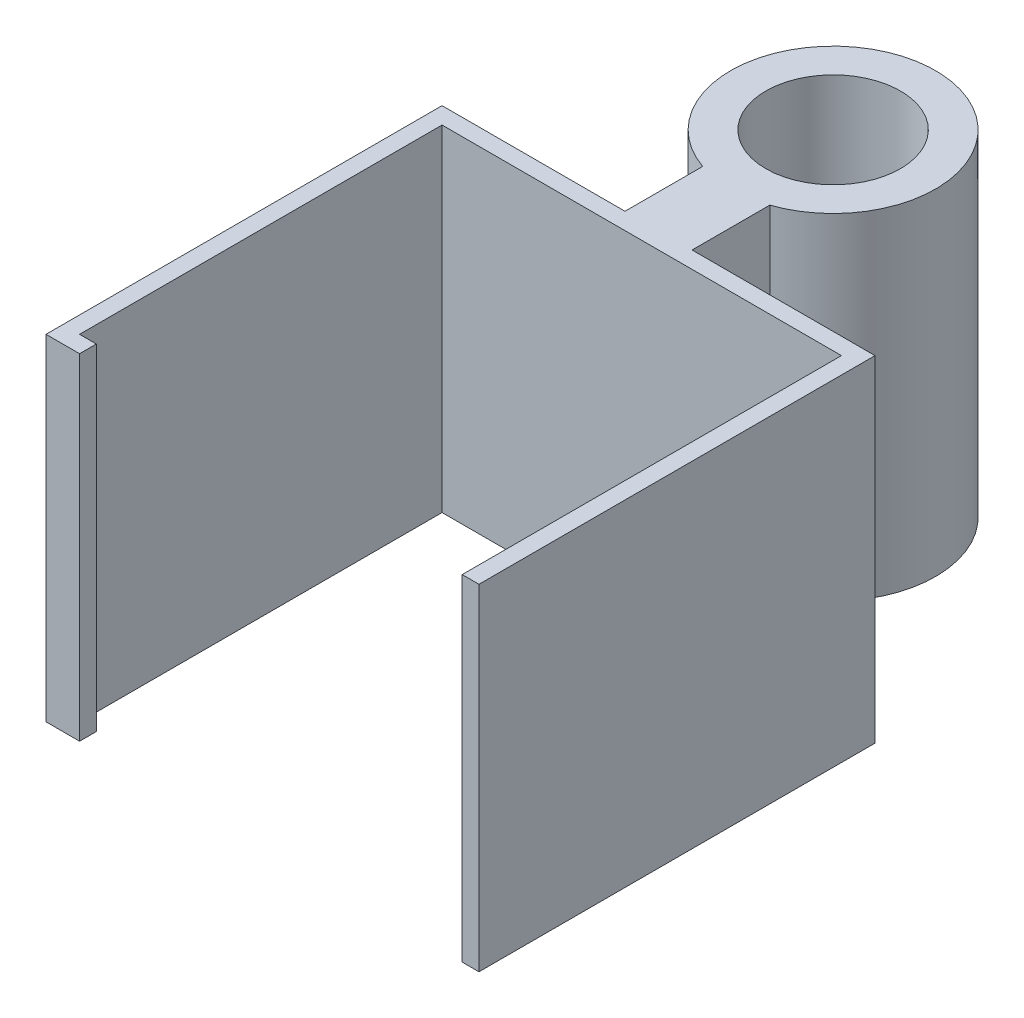
from build123d import *

# Parameters (mm, degrees)
SKETCH3_W           = 12.9
SKETCH3_H           = 11.8
BOSS_EXTRUDE2_DEPTH = 10
SKETCH4_W           = 11.9
SKETCH4_H           = 10.8
CUT_EXTRUDE1_DEPTH  = 10
SKETCH5_W           = 11.3990209
SKETCH5_H           = 5.9
CUT_EXTRUDE2_DEPTH  = 10
SKETCH6_W           = 1.998577766
SKETCH6_H           = 2.842465616
BOSS_EXTRUDE3_DEPTH = 10
SKETCH7_R           = 3.054866119
BOSS_EXTRUDE4_DEPTH = 10
SKETCH8_R           = 2.006377858
CUT_EXTRUDE3_DEPTH  = 10


with BuildPart() as part:
    # Sketch3 → Boss-Extrude2 (new body)
    with BuildSketch(Plane(origin=(0, 0, 0), x_dir=(1, 0, 0), z_dir=(0, 1, 0))):
        Rectangle(SKETCH3_W, SKETCH3_H)
    extrude(amount=BOSS_EXTRUDE2_DEPTH)

    # Sketch4 → Cut-Extrude1 (cut)
    with BuildSketch(Plane(origin=(0, 0, 0), x_dir=(1, 0, 0), z_dir=(0, 1, 0))):
        Rectangle(SKETCH4_W, SKETCH4_H)
    extrude(amount=CUT_EXTRUDE1_DEPTH, mode=Mode.SUBTRACT)

    # Sketch5 → Cut-Extrude2 (cut)
    with BuildSketch(Plane(origin=(0, 0, 0), x_dir=(1, 0, 0), z_dir=(0, 1, 0))):
        with Locations((0.25048955, -2.95)):
            Rectangle(SKETCH5_W, SKETCH5_H)
    extrude(amount=CUT_EXTRUDE2_DEPTH, mode=Mode.SUBTRACT)

    # Sketch6 → Boss-Extrude3 (add)
    with BuildSketch(Plane(origin=(0, 0, 0), x_dir=(1, 0, 0), z_dir=(0, 1, 0))):
        with Locations((0, 6.821232808)):
            Rectangle(SKETCH6_W, SKETCH6_H)
    extrude(amount=BOSS_EXTRUDE3_DEPTH)

    # Sketch7 → Boss-Extrude4 (add)
    with BuildSketch(Plane(origin=(0, 0, 0), x_dir=(1, 0, 0), z_dir=(0, 1, 0))):
        with Locations((0, 11.101611726)):
            Circle(SKETCH7_R)
    extrude(amount=BOSS_EXTRUDE4_DEPTH)

    # Sketch8 → Cut-Extrude3 (cut)
    with BuildSketch(Plane(origin=(0, 0, 0), x_dir=(1, 0, 0), z_dir=(0, 1, 0))):
        with Locations(Location((0, 11.101611726, 0), (0, 0, 270))):
            Circle(SKETCH8_R)
    extrude(amount=CUT_EXTRUDE3_DEPTH, mode=Mode.SUBTRACT)


solid = part.part
